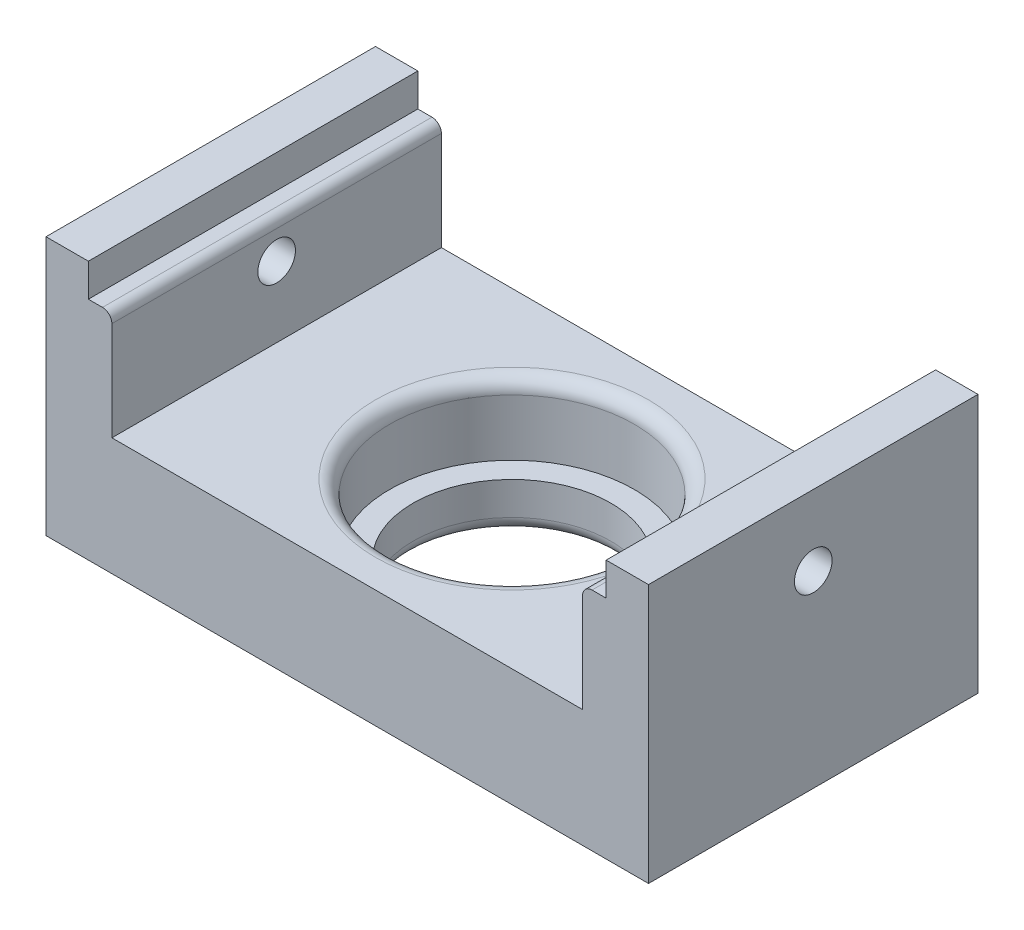
from build123d import *

# Parameters (mm, degrees)
DODANIE_WYCI_GNI_CIE1_DEPTH  = 12.5
SZKIC3_R                     = 13
WYTNIJ_WYCI_GNI_CIE1_DEPTH   = 7.5
SZKIC4_W                     = 7
SZKIC4_H                     = 35
DODANIE_WYCI_GNI_CIE2_DEPTH  = 15
SZKIC6_R                     = 2
WYTNIJ_WYCI_GNI_CIE2_DEPTH   = 7
WYTNIJ_WYCI_GNI_CIE3_START   = -7
SZKIC7_R                     = 2
WYTNIJ_WYCI_GNI_CIE3_DEPTH   = 7
ZAOKR_GLENIE2_R              = 1.5
ZAOKR_GLENIE3_R              = 1.5
SZKIC8_W                     = 2.5
SZKIC8_H                     = 35
WYTNIJ_WYCI_GNI_CIE4_DEPTH   = 3.5
ZAOKR_GLENIE4_R              = 1
OBIEKT_PRZENIE_KOPIUJ1_ANGLE = 90


with BuildPart() as part:
    # Szkic2 → Dodanie-wyciągnięcie1 (new body)
    with BuildSketch(Plane.XY):
        with BuildLine():
            ThreePointArc((0, -10.5), (-10.5, 0), (0, 10.5))
            Line((0, 10.5), (-32, 10.5))
            Line((-32, 10.5), (-32, -10.5))
            Line((-32, -10.5), (0, -10.5))
        make_face()
        with BuildLine():
            Line((32, 10.5), (0, 10.5))
            ThreePointArc((0, 10.5), (7.424621202, 7.424621202), (10.5, 0))
            ThreePointArc((10.5, 0), (7.424621202, -7.424621202), (0, -10.5))
            Line((0, -10.5), (32, -10.5))
            Line((32, -10.5), (32, 10.5))
        make_face()
        Polygon((0, 10.5), (32, 10.5), (32, 17.5), (-32, 17.5), (-32, 10.5), align=None)
        Polygon((32, -10.5), (32, -17.5), (-32, -17.5), (-32, -10.5), (0, -10.5), align=None)
    extrude(amount=DODANIE_WYCI_GNI_CIE1_DEPTH)

    # Szkic3 → Wytnij-wyciągnięcie1 (cut)
    with BuildSketch(Plane.XY.offset(12.5)):
        Circle(SZKIC3_R)
    extrude(amount=-WYTNIJ_WYCI_GNI_CIE1_DEPTH, mode=Mode.SUBTRACT)

    # Szkic4 → Dodanie-wyciągnięcie2 (add)
    with BuildSketch(Plane.XY.offset(12.5)):
        with Locations((-28.5, 0)):
            Rectangle(SZKIC4_W, SZKIC4_H)
        with Locations((28.5, 0)):
            Rectangle(SZKIC4_W, SZKIC4_H)
    extrude(amount=DODANIE_WYCI_GNI_CIE2_DEPTH)

    # Szkic6 → Wytnij-wyciągnięcie2 (cut)
    with BuildSketch(Plane.ZY.offset(-25)):
        with Locations(Location((20, 0, 0), (0, 0, 270))):
            Circle(SZKIC6_R)
    extrude(amount=-WYTNIJ_WYCI_GNI_CIE2_DEPTH, mode=Mode.SUBTRACT)

    # Szkic7 → Wytnij-wyciągnięcie3 (cut)
    with BuildSketch(Plane(origin=(-25, 0, 0), x_dir=(0, 0, -1), z_dir=(1, 0, 0)).offset(WYTNIJ_WYCI_GNI_CIE3_START)):
        with Locations(Location((-20, 0, 0), (0, 0, 270))):
            Circle(SZKIC7_R)
    extrude(amount=WYTNIJ_WYCI_GNI_CIE3_DEPTH, mode=Mode.SUBTRACT)

    # Zaokrąglenie2
    zaokr_glenie2_edges = [part.edges().sort_by_distance(p)[0] for p in [
        (-13, 0, 12.5),
    ]]
    fillet(zaokr_glenie2_edges, radius=ZAOKR_GLENIE2_R)

    # Zaokrąglenie3
    zaokr_glenie3_edges = [part.edges().sort_by_distance(p)[0] for p in [
        (0, 10.5, 0),
    ]]
    fillet(zaokr_glenie3_edges, radius=ZAOKR_GLENIE3_R)

    # Szkic8 → Wytnij-wyciągnięcie4 (cut)
    with BuildSketch(Plane.XY.offset(27.5)):
        with Locations((-26.25, 0)):
            Rectangle(SZKIC8_W, SZKIC8_H)
        with Locations((26.25, 0)):
            Rectangle(SZKIC8_W, SZKIC8_H)
    extrude(amount=-WYTNIJ_WYCI_GNI_CIE4_DEPTH, mode=Mode.SUBTRACT)

    # Zaokrąglenie4
    zaokr_glenie4_edges = [part.edges().sort_by_distance(p)[0] for p in [
        (-25, 0, 24),
        (25, 0, 24),
    ]]
    fillet(zaokr_glenie4_edges, radius=ZAOKR_GLENIE4_R)


with BuildPart() as part_1:
    # Obiekt-Przenieś/Kopiuj1: moved
    add(part.part.rotate(Axis((0, 0, 13.75), (-1, 0, 0)), OBIEKT_PRZENIE_KOPIUJ1_ANGLE))


solid = part_1.part
